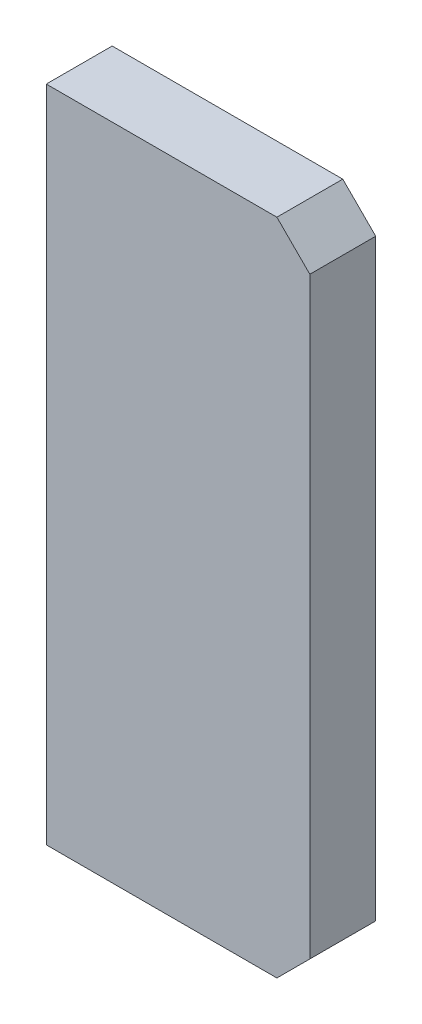
from build123d import *

# Parameters (mm, degrees)
SKETCH1_W           = 1000
SKETCH1_H           = 400
BOSS_EXTRUDE1_DEPTH = 100
CHAMFER1_SIZE       = 50


with BuildPart() as part:
    # Sketch1 → Boss-Extrude1 (new body)
    with BuildSketch(Plane(origin=(0, 0, 0), x_dir=(0, 1, 0), z_dir=(0, 0, 1))):
        Rectangle(SKETCH1_W, SKETCH1_H)
    extrude(amount=BOSS_EXTRUDE1_DEPTH)

    # Chamfer1
    chamfer1_edges = [part.edges().sort_by_distance(p)[0] for p in [
        (200, 500, 50),
        (200, -500, 50),
    ]]
    chamfer(chamfer1_edges, length=CHAMFER1_SIZE)


solid = part.part
